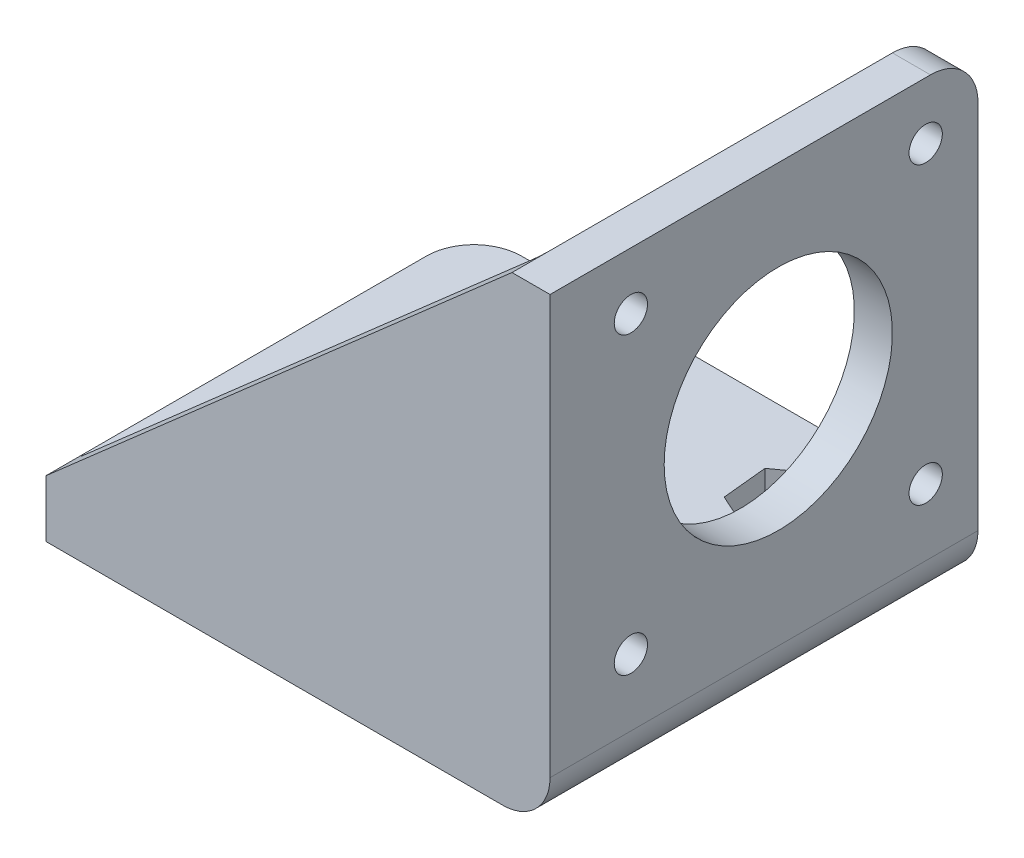
from build123d import *

# Parameters (mm, degrees)
ESBO_O1_W                = 53
ESBO_O1_H                = 45
RESSALTO_EXTRUS_O1_DEPTH = 6
ESBO_O2_W                = 4
ESBO_O2_H                = 45
RESSALTO_EXTRUS_O2_DEPTH = 43
RESSALTO_EXTRUS_O3_DEPTH = 3
ESBO_O4_R                = 12
ESBO_O4_R_2              = 1.75
CORTE_EXTRUS_O1_DEPTH    = 73.857738093
ESBO_O5_R                = 2.75
CORTE_EXTRUS_O2_DEPTH    = 56.294665204
FILETE1_R                = 5
FILETE2_R                = 1
CORTE_EXTRUS_O4_DEPTH    = 4
FILETE3_R                = 5


with BuildPart() as part:
    # Esboço1 → Ressalto-extrusão1 (new body)
    with BuildSketch(Plane(origin=(0, 0, 0), x_dir=(1, 0, 0), z_dir=(0, 1, 0))):
        Rectangle(ESBO_O1_W, ESBO_O1_H)
    extrude(amount=RESSALTO_EXTRUS_O1_DEPTH)

    # Esboço2 → Ressalto-extrusão2 (add)
    with BuildSketch(Plane(origin=(0, 6, 0), x_dir=(1, 0, 0), z_dir=(0, 1, 0))):
        with Locations((24.5, 0)):
            Rectangle(ESBO_O2_W, ESBO_O2_H)
    extrude(amount=RESSALTO_EXTRUS_O2_DEPTH)

    # Esboço3 → Ressalto-extrusão3 (add)
    with BuildSketch(Plane.XY.offset(22.5)):
        Polygon((-26.5, 6), (22.5, 49), (22.5, 6), align=None)
    extrude(amount=-RESSALTO_EXTRUS_O3_DEPTH)

    # Esboço4 → Corte-extrusão1 (cut, through all)
    with BuildSketch(Plane.ZY.offset(-22.5)):
        with Locations((-1.5, 27.5)):
            Circle(ESBO_O4_R)
        with Locations((-17, 43)):
            Circle(ESBO_O4_R_2)
        with Locations((14, 43)):
            Circle(ESBO_O4_R_2)
        with Locations((14, 12)):
            Circle(ESBO_O4_R_2)
        with Locations((-17, 12)):
            Circle(ESBO_O4_R_2)
    extrude(amount=-CORTE_EXTRUS_O1_DEPTH, mode=Mode.SUBTRACT)

    # Esboço5 → Corte-extrusão2 (cut, through all)
    with BuildSketch(Plane(origin=(0, 6, 0), x_dir=(1, 0, 0), z_dir=(0, 1, 0))):
        with Locations(Location((-15, 14, 0), (0, 0, 270))):
            Circle(ESBO_O5_R)
        with Locations(Location((-15, -11, 0), (0, 0, 270))):
            Circle(ESBO_O5_R)
        with Locations(Location((15, -11, 0), (0, 0, 90))):
            Circle(ESBO_O5_R)
        with Locations(Location((15, 14, 0), (0, 0, 90))):
            Circle(ESBO_O5_R)
    extrude(amount=-CORTE_EXTRUS_O2_DEPTH, mode=Mode.SUBTRACT)

    # Filete1
    filete1_edges = [part.edges().sort_by_distance(p)[0] for p in [
        (24.5, 49, -22.5),
        (-26.5, 3, -22.5),
    ]]
    fillet(filete1_edges, radius=FILETE1_R)

    # Filete2
    filete2_edges = [part.edges().sort_by_distance(p)[0] for p in [
        (22.5, 6, -1.5),
        (-2, 6, 19.5),
        (22.5, 27.5, 19.5),
    ]]
    fillet(filete2_edges, radius=FILETE2_R)

    # Esboço7 → Corte-extrusão4 (cut)
    with BuildSketch(Plane(origin=(0, 6, 0), x_dir=(1, 0, 0), z_dir=(0, 1, 0))):
        Polygon((15.473054225, 9.231399258), (19.366256495, 12.025376605), (18.89320227, 16.793977347), (14.526945775, 18.768600742), (10.633743505, 15.974623395), (11.10679773, 11.206022653), align=None)
        Polygon((-14.526945775, 9.231399258), (-10.633743505, 12.025376605), (-11.10679773, 16.793977347), (-15.473054225, 18.768600742), (-19.366256495, 15.974623395), (-18.89320227, 11.206022653), align=None)
        Polygon((15.473054225, -15.768600742), (19.366256495, -12.974623395), (18.89320227, -8.206022653), (14.526945775, -6.231399258), (10.633743505, -9.025376605), (11.10679773, -13.793977347), align=None)
        Polygon((-14.526945775, -15.768600742), (-10.633743505, -12.974623395), (-11.10679773, -8.206022653), (-15.473054225, -6.231399258), (-19.366256495, -9.025376605), (-18.89320227, -13.793977347), align=None)
    extrude(amount=-CORTE_EXTRUS_O4_DEPTH, mode=Mode.SUBTRACT)

    # Filete3
    filete3_edges = [part.edges().sort_by_distance(p)[0] for p in [
        (26.5, 0, 0),
    ]]
    fillet(filete3_edges, radius=FILETE3_R)


solid = part.part
